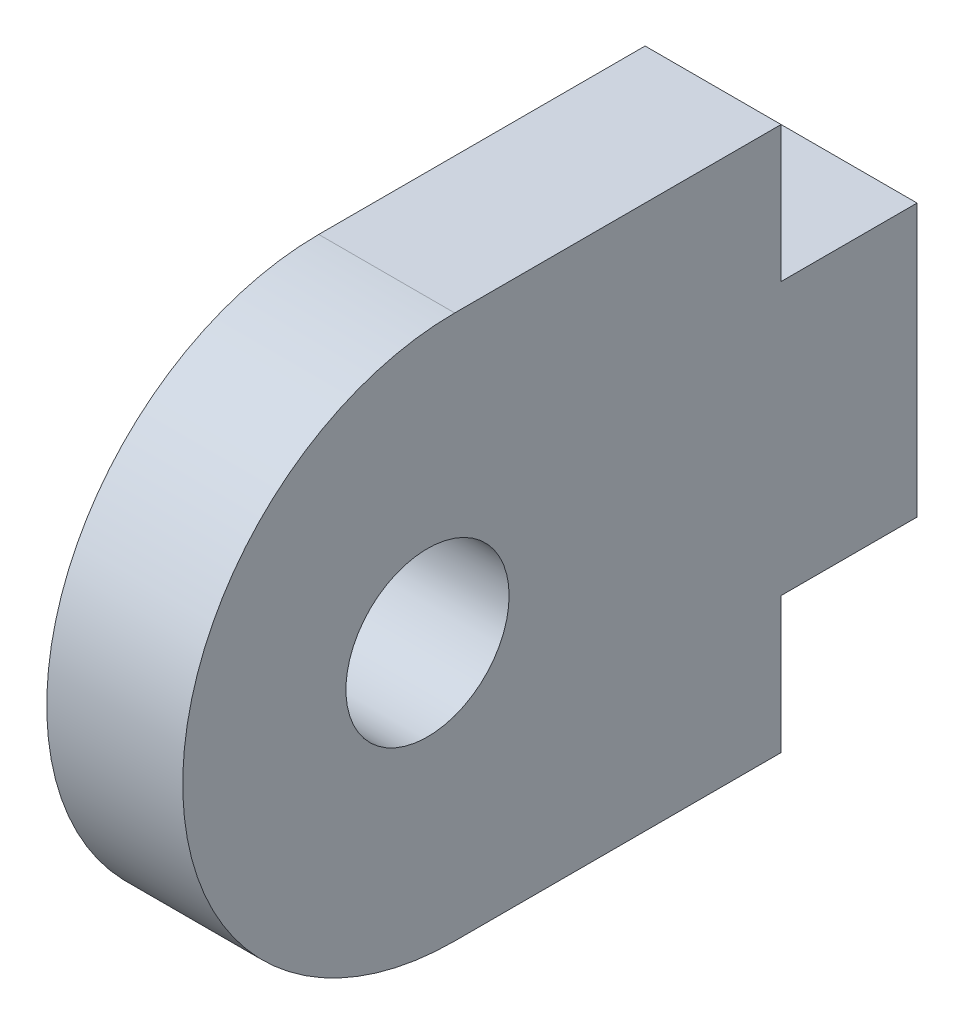
from build123d import *

# Parameters (mm, degrees)
SKETCH1_R           = 3
BOSS_EXTRUDE1_DEPTH = 2.5
FILLET1_RADIUS      = 10
FILLET1_LENGTH      = 5


with BuildPart() as part:
    # Sketch1 → Boss-Extrude1 (new, symmetric)
    with BuildSketch(Plane.YZ):
        Polygon((-5, 0), (5, 0), (5, 5), (10, 5), (10, 27), (-10, 27), (-10, 5), (-5, 5), align=None)
        with Locations(Location((0, 18, 0), (0, 0, 270))):
            Circle(SKETCH1_R, mode=Mode.SUBTRACT)
    extrude(amount=BOSS_EXTRUDE1_DEPTH, both=True)

    # Fillet1: full round fillet: the end face becomes a half cylinder, R = half its width
    fillet1_face = Plane((0, 0, 27), x_dir=(-1, 0, 0), z_dir=(0, 0, 1))  # on the end face: x along it, z out of the body
    fillet1_slab = fillet1_face.offset(-FILLET1_RADIUS / 2) * Box(FILLET1_LENGTH, 2 * FILLET1_RADIUS, FILLET1_RADIUS, mode=Mode.PRIVATE)  # the body's end, R deep
    fillet1_round = Plane((0, 0, 17), x_dir=(0, 0, 1), z_dir=(-1, 0, 0)) * Cylinder(FILLET1_RADIUS, FILLET1_LENGTH, mode=Mode.PRIVATE)  # its axis R under the face
    add(fillet1_slab - fillet1_round, mode=Mode.SUBTRACT)


solid = part.part
